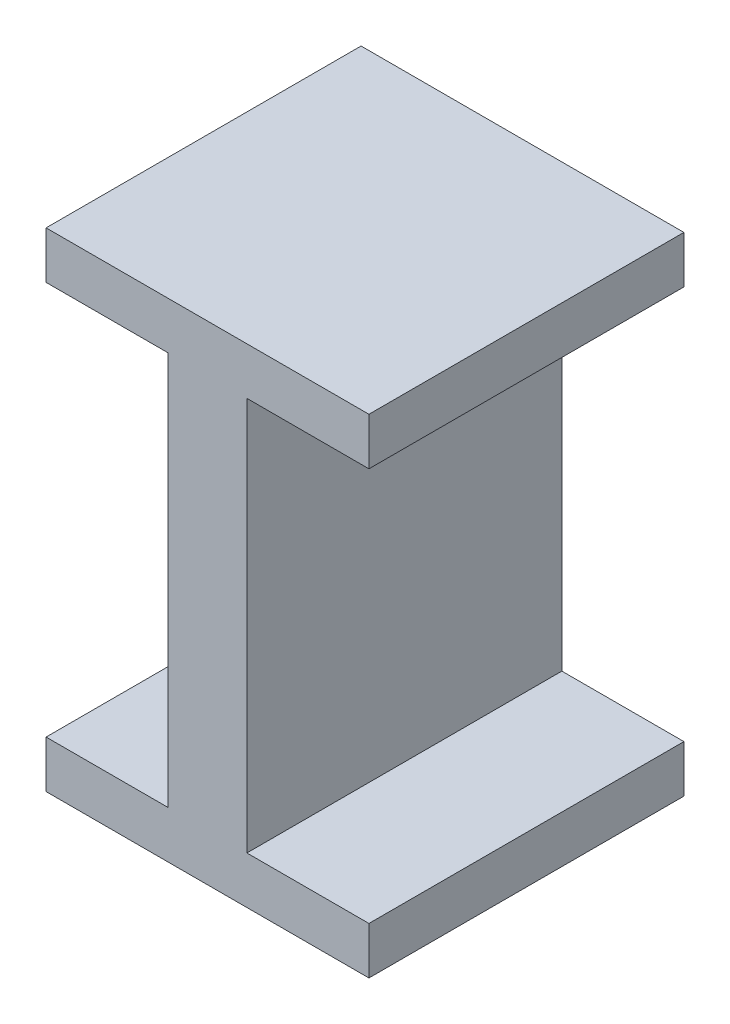
from build123d import *

# Parameters (mm, degrees)
SKETCH_1_W      = 41
SKETCH_1_H      = 40
EXTRUDE_1_DEPTH = 6
SKETCH_2_W      = 10
SKETCH_2_H      = 40
EXTRUDE_2_DEPTH = 50
SKETCH_3_W      = 41
SKETCH_3_H      = 40
EXTRUDE_3_DEPTH = 6


with BuildPart() as part:
    # 草图1 → 凸台-拉伸1 (new body)
    with BuildSketch(Plane(origin=(0, 0, 0), x_dir=(1, 0, 0), z_dir=(0, 1, 0))):
        Rectangle(SKETCH_1_W, SKETCH_1_H)
    extrude(amount=EXTRUDE_1_DEPTH)

    # 草图2 → 凸台-拉伸2 (add)
    with BuildSketch(Plane(origin=(0, 6, 0), x_dir=(1, 0, 0), z_dir=(0, 1, 0))):
        Rectangle(SKETCH_2_W, SKETCH_2_H)
    extrude(amount=EXTRUDE_2_DEPTH)

    # 草图3 → 凸台-拉伸3 (add)
    with BuildSketch(Plane(origin=(0, 56, 0), x_dir=(1, 0, 0), z_dir=(0, 1, 0))):
        Rectangle(SKETCH_3_W, SKETCH_3_H)
    extrude(amount=EXTRUDE_3_DEPTH)


solid = part.part
